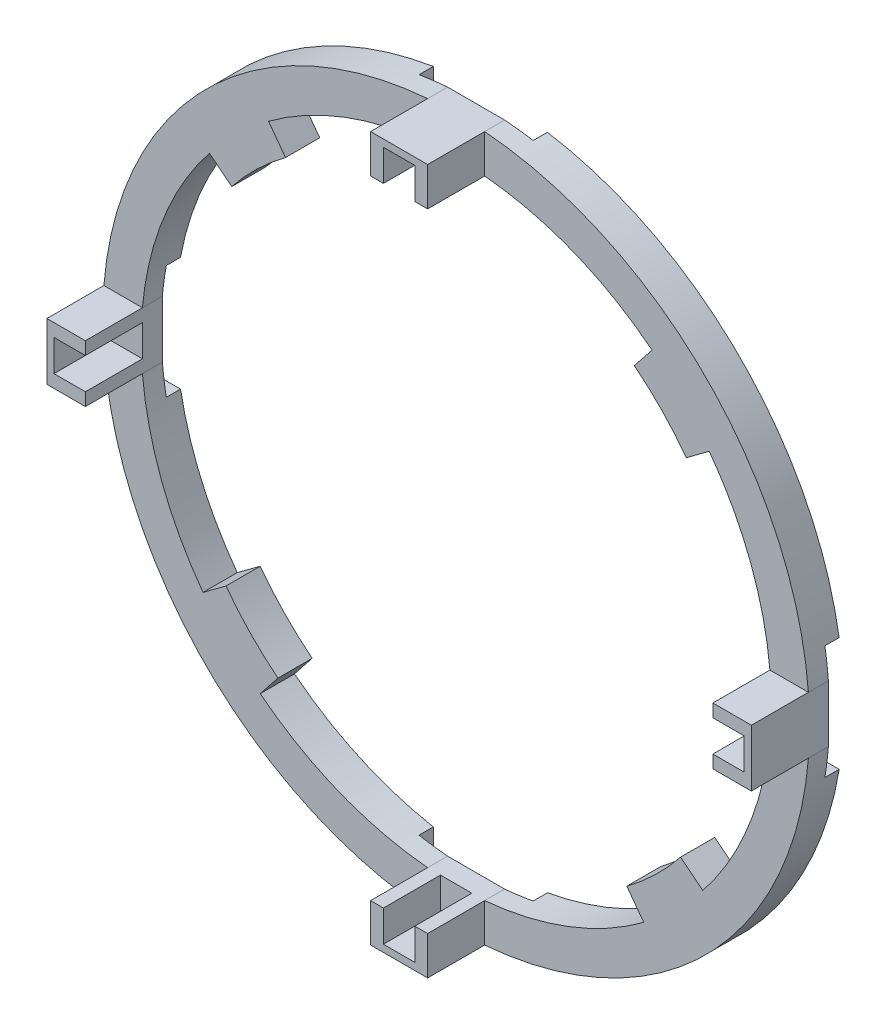
from build123d import *

# Parameters (mm, degrees)
BOSS_EXTRUDE1_DEPTH   = 20
BOSS_EXTRUDE1_2_DEPTH = 20
BOSS_EXTRUDE1_3_DEPTH = 20
BOSS_EXTRUDE1_4_DEPTH = 20
BOSS_EXTRUDE2_DEPTH   = 12
SKETCH5_W             = 25
SKETCH5_H             = 40
SKETCH5_W_2           = 40
SKETCH5_H_2           = 25
CUT_EXTRUDE1_DEPTH    = 5


with BuildPart() as part:
    # Sketch2 → Boss-Extrude1 (new body)
    with BuildSketch(Plane.XY):
        Polygon((110, 10), (123.5, 10), (123.5, -10), (110, -10), (110, -5.5), (114.5, -5.5), (121, -5.5), (121, 5.5), (114.5, 5.5), (110, 5.5), align=None)
    extrude(amount=BOSS_EXTRUDE1_DEPTH)



with BuildPart() as body_2:
    # Sketch2 → Boss-Extrude1 2 (new body)
    with BuildSketch(Plane.XY):
        Polygon((10, -110), (10, -123.5), (-10, -123.5), (-10, -110), (-5.5, -110), (-5.5, -114.5), (-5.5, -121), (5.5, -121), (5.5, -114.5), (5.5, -110), align=None)
    extrude(amount=BOSS_EXTRUDE1_2_DEPTH)


with BuildPart() as body_3:
    # Sketch2 → Boss-Extrude1 3 (new body)
    with BuildSketch(Plane.XY):
        Polygon((-110, -10), (-123.5, -10), (-123.5, 10), (-110, 10), (-110, 5.5), (-114.5, 5.5), (-121, 5.5), (-121, -5.5), (-114.5, -5.5), (-110, -5.5), align=None)
    extrude(amount=BOSS_EXTRUDE1_3_DEPTH)


with BuildPart() as body_4:
    # Sketch2 → Boss-Extrude1 4 (new body)
    with BuildSketch(Plane.XY):
        Polygon((-10, 110), (-5.5, 110), (-5.5, 114.5), (-5.5, 121), (5.5, 121), (5.5, 114.5), (5.5, 110), (10, 110), (10, 123.5), (-10, 123.5), align=None)
    extrude(amount=BOSS_EXTRUDE1_4_DEPTH)


with BuildPart() as part_1:
    add(part.part)

    add(body_2.part)  # Boss-Extrude2 merges body 2

    add(body_3.part)  # Boss-Extrude2 merges body 3

    add(body_4.part)  # Boss-Extrude2 merges body 4
    # Sketch3 → Boss-Extrude2 (add)
    with BuildSketch(Plane(origin=(0, 0, 0), x_dir=(-1, 0, 0), z_dir=(0, 0, -1))):
        with BuildLine():
            Line((10, 123.5), (-10, 123.5))
            ThreePointArc((-10, 123.5), (-87.613497819, 87.613497819), (-123.5, 10))
            Line((-123.5, 10), (-123.5, -10))
            ThreePointArc((-123.5, -10), (-87.613497819, -87.613497819), (-10, -123.5))
            Line((-10, -123.5), (10, -123.5))
            ThreePointArc((10, -123.5), (87.613497819, -87.613497819), (123.5, -10))
            Line((123.5, -10), (123.5, 10))
            ThreePointArc((123.5, 10), (87.613497819, 87.613497819), (10, 123.5))
        make_face()
        with BuildLine():
            ThreePointArc((-110, 10), (-103.205416168, 39.352789909), (-88.731734836, 65.777497923))
            Line((-88.731734836, 65.777497923), (-80.698341025, 59.822283075))
            ThreePointArc((-80.698341025, 59.822283075), (-72.199580711, 69.843742323), (-62.465465553, 78.670155776))
            Line((-62.465465553, 78.670155776), (-68.683805088, 86.501646913))
            ThreePointArc((-68.683805088, 86.501646913), (-41.058841255, 102.538634449), (-10, 110))
            Line((-10, 110), (10, 110))
            ThreePointArc((10, 110), (39.352789909, 103.205416168), (65.777497923, 88.731734836))
            Line((65.777497923, 88.731734836), (59.822283075, 80.698341025))
            ThreePointArc((59.822283075, 80.698341025), (69.843742323, 72.199580711), (78.670155776, 62.465465553))
            Line((78.670155776, 62.465465553), (86.501646913, 68.683805088))
            ThreePointArc((86.501646913, 68.683805088), (102.538634449, 41.058841255), (110, 10))
            Line((110, 10), (110, -10))
            ThreePointArc((110, -10), (103.205416168, -39.352789909), (88.731734836, -65.777497923))
            Line((88.731734836, -65.777497923), (80.698341025, -59.822283075))
            ThreePointArc((80.698341025, -59.822283075), (72.199580711, -69.843742323), (62.465465553, -78.670155776))
            Line((62.465465553, -78.670155776), (68.683805088, -86.501646913))
            ThreePointArc((68.683805088, -86.501646913), (41.058841255, -102.538634449), (10, -110))
            Line((10, -110), (-10, -110))
            ThreePointArc((-10, -110), (-39.352789909, -103.205416168), (-65.777497923, -88.731734836))
            Line((-65.777497923, -88.731734836), (-59.822283075, -80.698341025))
            ThreePointArc((-59.822283075, -80.698341025), (-69.843742323, -72.199580711), (-78.670155776, -62.465465553))
            Line((-78.670155776, -62.465465553), (-86.501646913, -68.683805088))
            ThreePointArc((-86.501646913, -68.683805088), (-102.538634449, -41.058841255), (-110, -10))
            Line((-110, -10), (-110, -5.5))
            Line((-110, -5.5), (-110, 5.5))
            Line((-110, 5.5), (-110, 10))
        make_face(mode=Mode.SUBTRACT)
    extrude(amount=BOSS_EXTRUDE2_DEPTH)

    # Sketch5 → Cut-Extrude1 (cut)
    with BuildSketch(Plane(origin=(0, 0, -12), x_dir=(-1, 0, 0), z_dir=(0, 0, -1))):
        with Locations((-116.75, 0)):
            Rectangle(SKETCH5_W, SKETCH5_H)
        with Locations((0, 116.75)):
            Rectangle(SKETCH5_W_2, SKETCH5_H_2)
        with Locations((116.75, 0)):
            Rectangle(SKETCH5_W, SKETCH5_H)
        with Locations((0, -116.75)):
            Rectangle(SKETCH5_W_2, SKETCH5_H_2)
    extrude(amount=-CUT_EXTRUDE1_DEPTH, mode=Mode.SUBTRACT)


solid = part_1.part
